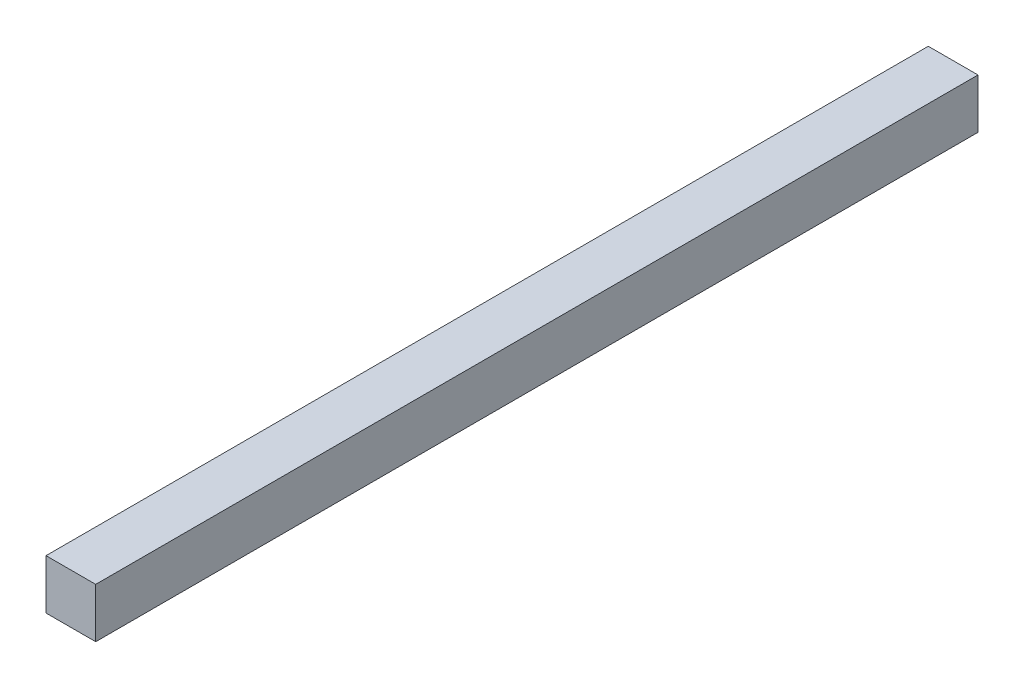
from build123d import *

# Parameters (mm, degrees)
SKETCH1_W           = 40
SKETCH1_H           = 40
BOSS_EXTRUDE1_DEPTH = 710


with BuildPart() as part:
    # Sketch1 → Boss-Extrude1 (new body)
    with BuildSketch(Plane.XY):
        with Locations((-5.435897436, 5.230769231)):
            Rectangle(SKETCH1_W, SKETCH1_H)
    extrude(amount=BOSS_EXTRUDE1_DEPTH)


solid = part.part
